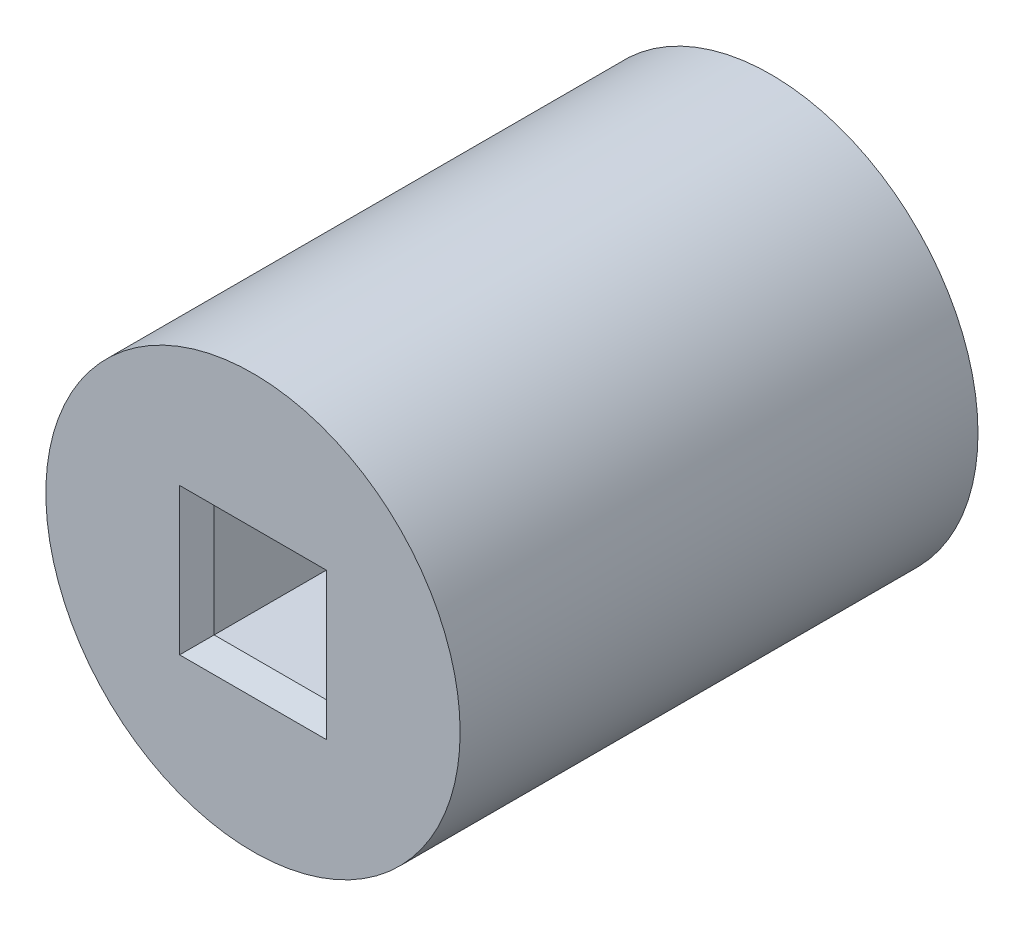
from build123d import *

# Parameters (mm, degrees)
SKETCH1_R           = 6
BOSS_EXTRUDE1_DEPTH = 15
SKETCH2_R           = 2.6
CUT_EXTRUDE1_DEPTH  = 10
SKETCH5_W           = 3.25
SKETCH5_H           = 3.25
CUT_EXTRUDE2_DEPTH  = 5
CHAMFER1_SIZE       = 0.5


with BuildPart() as part:
    # Sketch1 → Boss-Extrude1 (new body)
    with BuildSketch(Plane.XY):
        Circle(SKETCH1_R)
    extrude(amount=BOSS_EXTRUDE1_DEPTH)

    # Sketch2 → Cut-Extrude1 (cut)
    with BuildSketch(Plane(origin=(0, 0, 0), x_dir=(-1, 0, 0), z_dir=(0, 0, -1))):
        Circle(SKETCH2_R)
    extrude(amount=-CUT_EXTRUDE1_DEPTH, mode=Mode.SUBTRACT)

    # Sketch5 → Cut-Extrude2 (cut)
    with BuildSketch(Plane.XY.offset(15)):
        Rectangle(SKETCH5_W, SKETCH5_H)
    extrude(amount=-CUT_EXTRUDE2_DEPTH, mode=Mode.SUBTRACT)

    # Chamfer1
    chamfer1_edges = [part.edges().sort_by_distance(p)[0] for p in [
        (1.625, 0, 15),
        (0, 1.625, 15),
        (-1.625, 0, 15),
        (0, -1.625, 15),
        (2.6, 0, 0),
    ]]
    chamfer(chamfer1_edges, length=CHAMFER1_SIZE)


solid = part.part
